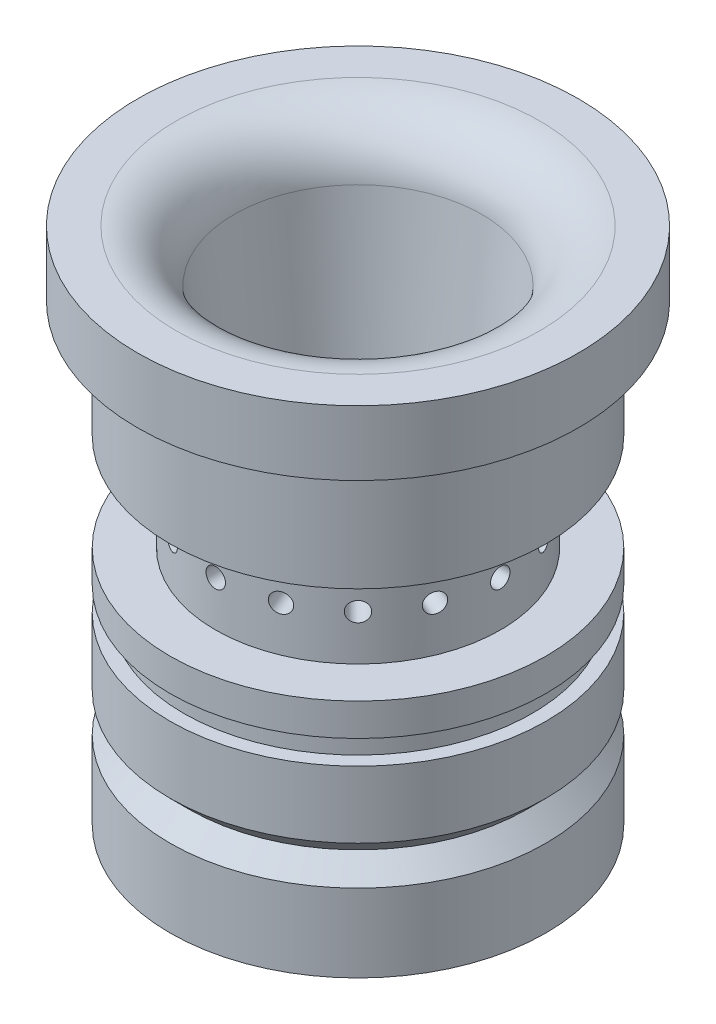
from build123d import *

# Parameters (mm, degrees)
SKETCH2_R          = 1.5
CUT_EXTRUDE3_DEPTH = 66.176682947
CIRPATTERN1_COUNT  = 16


with BuildPart() as part:
    # Sketch1 → Revolve1 (revolve)
    with BuildSketch(Plane.XY, mode=Mode.PRIVATE) as revolve1_sk:
        with BuildLine():
            Line((21.5, -44), (16.019510288, 0))
            Line((16.019510288, 0), (19.109371065, 27.9876088))
            ThreePointArc((19.109371065, 27.9876088), (22.050374762, 33.704046509), (28.055019665, 36))
            Line((28.055019665, 36), (34, 36))
            Line((34, 36), (34, 26))
            Line((34, 26), (29, 26))
            Line((29, 26), (29, 8))
            Line((29, 8), (22, 8))
            Line((22, 8), (22, -7))
            Line((22, -7), (29, -7))
            Line((29, -7), (29, -12))
            Line((29, -12), (26.9, -12))
            Line((26.9, -12), (26.9, -15.7))
            Line((26.9, -15.7), (29, -15.7))
            Line((29, -15.7), (29, -26))
            Line((29, -26), (26, -29))
            Line((26, -29), (29, -32))
            Line((29, -32), (29, -44))
            Line((29, -44), (21.5, -44))
        make_face()
    revolve(revolve1_sk.sketch.rotate(Axis((0, 70.209951592, 0), (0, -1, 0)), 90), axis=Axis((0, 70.209951592, 0), (0, -1, 0)))

    # Sketch2 → Cut-Extrude3 (cut, through all)
    with BuildSketch(Plane(origin=(0, 0, 0), x_dir=(0, 0, -1), z_dir=(1, 0, 0))):
        Circle(SKETCH2_R)
    cut_extrude3 = extrude(amount=-CUT_EXTRUDE3_DEPTH, mode=Mode.SUBTRACT)

    # CirPattern1: Cut-Extrude3 ×16 about axis
    cirpattern1_axis = Axis((0, 70.209951592, 0), (0, 1, 0))
    for i in range(1, CIRPATTERN1_COUNT):
        add(cut_extrude3.rotate(cirpattern1_axis, i * 360 / CIRPATTERN1_COUNT), mode=Mode.SUBTRACT)


solid = part.part
